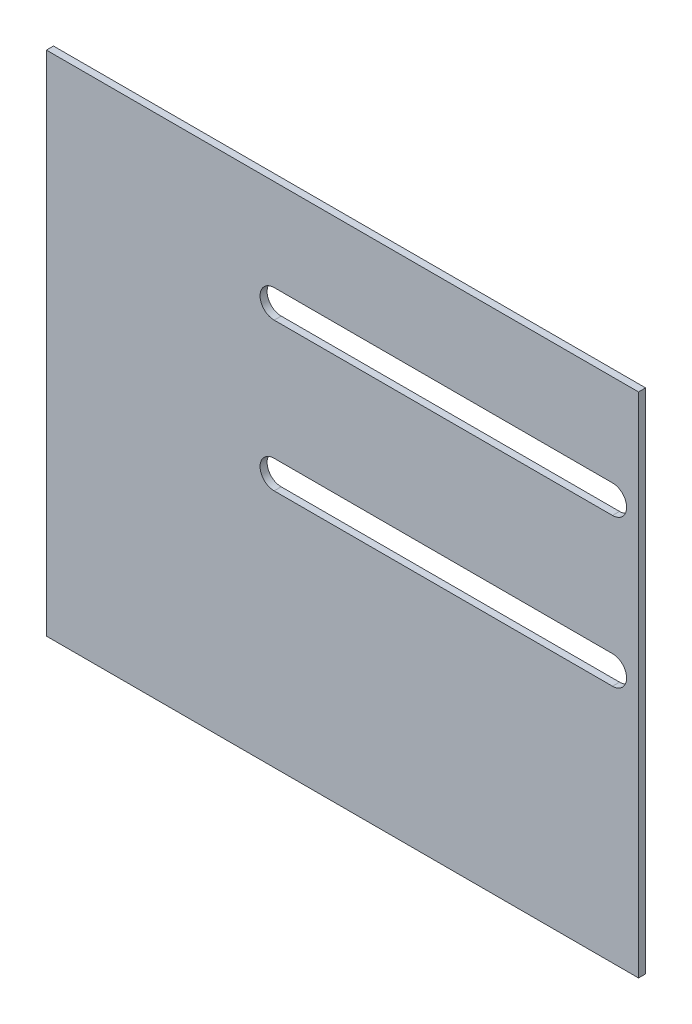
from build123d import *

# Parameters (mm, degrees)
SKETCH1_W           = 533.4
SKETCH1_H           = 457.2
BOSS_EXTRUDE4_DEPTH = 6.35


with BuildPart() as part:
    # Sketch1 → Boss-Extrude4 (new body)
    with BuildSketch(Plane.XY):
        Rectangle(SKETCH1_W, SKETCH1_H)
        with BuildLine():
            Line((-61.54804751, 145.902211593), (243.25195249, 145.902211593))
            ThreePointArc((243.25195249, 145.902211593), (255.95195249, 133.202211593), (243.25195249, 120.502211593))
            Line((243.25195249, 120.502211593), (-61.54804751, 120.502211593))
            ThreePointArc((-61.54804751, 120.502211593), (-74.24804751, 133.202211593), (-61.54804751, 145.902211593))
        make_face(mode=Mode.SUBTRACT)
        with BuildLine():
            Line((-61.54804751, 12.7), (243.25195249, 12.7))
            ThreePointArc((243.25195249, 12.7), (255.95195249, 0), (243.25195249, -12.7))
            Line((243.25195249, -12.7), (-61.54804751, -12.7))
            ThreePointArc((-61.54804751, -12.7), (-74.24804751, 0), (-61.54804751, 12.7))
        make_face(mode=Mode.SUBTRACT)
    extrude(amount=BOSS_EXTRUDE4_DEPTH)


solid = part.part
